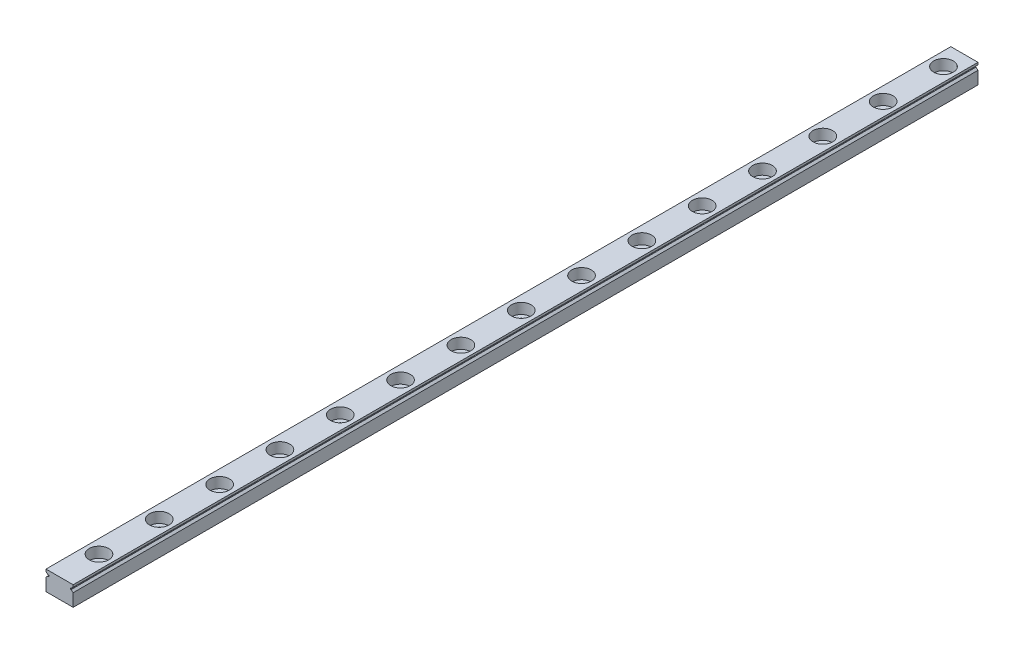
from build123d import *

# Parameters (mm, degrees)
EXTRUDE_1_DEPTH     = 300
SKETCH_2_R          = 1.75
CUT_EXTRUDE_3_DEPTH = 440
SKETCH_3_R          = 3.25
CUT_EXTRUDE_4_DEPTH = 3.5


with BuildPart() as part:
    # 草图1 → 凸台-拉伸1 (new body)
    with BuildSketch(Plane.XY):
        Polygon((0, 0), (-9, 0), (-9, 4.208125846), (-8.343397225, 4.785997189), (-8.055092033, 4.785997189), (-8.055092033, 5.184529149), (-8.343397225, 5.184529149), (-9, 5.762400492), (-9, 6.5), (0, 6.5), (0, 5.762400492), (-0.656602775, 5.184529149), (-0.944907967, 5.184529149), (-0.944907967, 4.785997189), (-0.656602775, 4.785997189), (0, 4.208125846), align=None)
    extrude(amount=EXTRUDE_1_DEPTH)

    # 草图2 → 切除-拉伸3 (cut)
    with BuildSketch(Plane(origin=(0, 6.5, 0), x_dir=(1, 0, 0), z_dir=(0, 1, 0))):
        with Locations(Location((-4.5, -6.942433545, 0), (0, 0, 180))):
            Circle(SKETCH_2_R)
        with Locations(Location((-4.5, -26.942433545, 0), (0, 0, 180))):
            Circle(SKETCH_2_R)
        with Locations(Location((-4.5, -46.942433545, 0), (0, 0, 180))):
            Circle(SKETCH_2_R)
        with Locations(Location((-4.5, -66.942433545, 0), (0, 0, 180))):
            Circle(SKETCH_2_R)
        with Locations(Location((-4.5, -86.942433545, 0), (0, 0, 180))):
            Circle(SKETCH_2_R)
        with Locations(Location((-4.5, -106.942433545, 0), (0, 0, 180))):
            Circle(SKETCH_2_R)
        with Locations(Location((-4.5, -126.942433545, 0), (0, 0, 180))):
            Circle(SKETCH_2_R)
        with Locations(Location((-4.5, -146.942433545, 0), (0, 0, 180))):
            Circle(SKETCH_2_R)
        with Locations(Location((-4.5, -166.942433545, 0), (0, 0, 180))):
            Circle(SKETCH_2_R)
        with Locations(Location((-4.5, -186.942433545, 0), (0, 0, 180))):
            Circle(SKETCH_2_R)
        with Locations(Location((-4.5, -206.942433545, 0), (0, 0, 180))):
            Circle(SKETCH_2_R)
        with Locations(Location((-4.5, -226.942433545, 0), (0, 0, 180))):
            Circle(SKETCH_2_R)
        with Locations(Location((-4.5, -246.942433545, 0), (0, 0, 180))):
            Circle(SKETCH_2_R)
        with Locations(Location((-4.5, -266.942433545, 0), (0, 0, 180))):
            Circle(SKETCH_2_R)
        with Locations(Location((-4.5, -286.942433545, 0), (0, 0, 180))):
            Circle(SKETCH_2_R)
        with Locations((-4.5, -306.942433545)):
            Circle(SKETCH_2_R)
        with Locations((-4.5, -326.942433545)):
            Circle(SKETCH_2_R)
        with Locations((-4.5, -346.942433545)):
            Circle(SKETCH_2_R)
        with Locations((-4.5, -366.942433545)):
            Circle(SKETCH_2_R)
        with Locations((-4.5, -386.942433545)):
            Circle(SKETCH_2_R)
        with Locations((-4.5, -406.942433545)):
            Circle(SKETCH_2_R)
        with Locations((-4.5, -426.942433545)):
            Circle(SKETCH_2_R)
    extrude(amount=-CUT_EXTRUDE_3_DEPTH, mode=Mode.SUBTRACT)

    # 草图3 → 切除-拉伸4 (cut)
    with BuildSketch(Plane(origin=(0, 6.5, 0), x_dir=(1, 0, 0), z_dir=(0, 1, 0))):
        with Locations(Location((-4.5, -6.942433545, 0), (0, 0, 180))):
            Circle(SKETCH_3_R)
        with Locations(Location((-4.5, -26.942433545, 0), (0, 0, 180))):
            Circle(SKETCH_3_R)
        with Locations(Location((-4.5, -46.942433545, 0), (0, 0, 180))):
            Circle(SKETCH_3_R)
        with Locations(Location((-4.5, -66.942433545, 0), (0, 0, 180))):
            Circle(SKETCH_3_R)
        with Locations(Location((-4.5, -86.942433545, 0), (0, 0, 180))):
            Circle(SKETCH_3_R)
        with Locations(Location((-4.5, -106.942433545, 0), (0, 0, 180))):
            Circle(SKETCH_3_R)
        with Locations(Location((-4.5, -126.942433545, 0), (0, 0, 180))):
            Circle(SKETCH_3_R)
        with Locations(Location((-4.5, -146.942433545, 0), (0, 0, 180))):
            Circle(SKETCH_3_R)
        with Locations(Location((-4.5, -166.942433545, 0), (0, 0, 180))):
            Circle(SKETCH_3_R)
        with Locations(Location((-4.5, -186.942433545, 0), (0, 0, 180))):
            Circle(SKETCH_3_R)
        with Locations(Location((-4.5, -206.942433545, 0), (0, 0, 180))):
            Circle(SKETCH_3_R)
        with Locations(Location((-4.5, -226.942433545, 0), (0, 0, 180))):
            Circle(SKETCH_3_R)
        with Locations(Location((-4.5, -246.942433545, 0), (0, 0, 180))):
            Circle(SKETCH_3_R)
        with Locations(Location((-4.5, -266.942433545, 0), (0, 0, 180))):
            Circle(SKETCH_3_R)
        with Locations(Location((-4.5, -286.942433545, 0), (0, 0, 180))):
            Circle(SKETCH_3_R)
        with Locations((-4.5, -306.942433545)):
            Circle(SKETCH_3_R)
        with Locations((-4.5, -326.942433545)):
            Circle(SKETCH_3_R)
        with Locations((-4.5, -346.942433545)):
            Circle(SKETCH_3_R)
        with Locations((-4.5, -366.942433545)):
            Circle(SKETCH_3_R)
        with Locations((-4.5, -386.942433545)):
            Circle(SKETCH_3_R)
        with Locations((-4.5, -406.942433545)):
            Circle(SKETCH_3_R)
        with Locations((-4.5, -426.942433545)):
            Circle(SKETCH_3_R)
        with Locations((-4.5, -446.942433545)):
            Circle(SKETCH_3_R)
        with Locations((-4.5, -466.942433545)):
            Circle(SKETCH_3_R)
        with Locations((-4.5, -486.942433545)):
            Circle(SKETCH_3_R)
        with Locations((-4.5, -506.942433545)):
            Circle(SKETCH_3_R)
        with Locations((-4.5, -526.942433545)):
            Circle(SKETCH_3_R)
        with Locations((-4.5, -546.942433545)):
            Circle(SKETCH_3_R)
        with Locations((-4.5, -566.942433545)):
            Circle(SKETCH_3_R)
        with Locations((-4.5, -586.942433545)):
            Circle(SKETCH_3_R)
        with Locations((-4.5, -606.942433545)):
            Circle(SKETCH_3_R)
    extrude(amount=-CUT_EXTRUDE_4_DEPTH, mode=Mode.SUBTRACT)


solid = part.part
